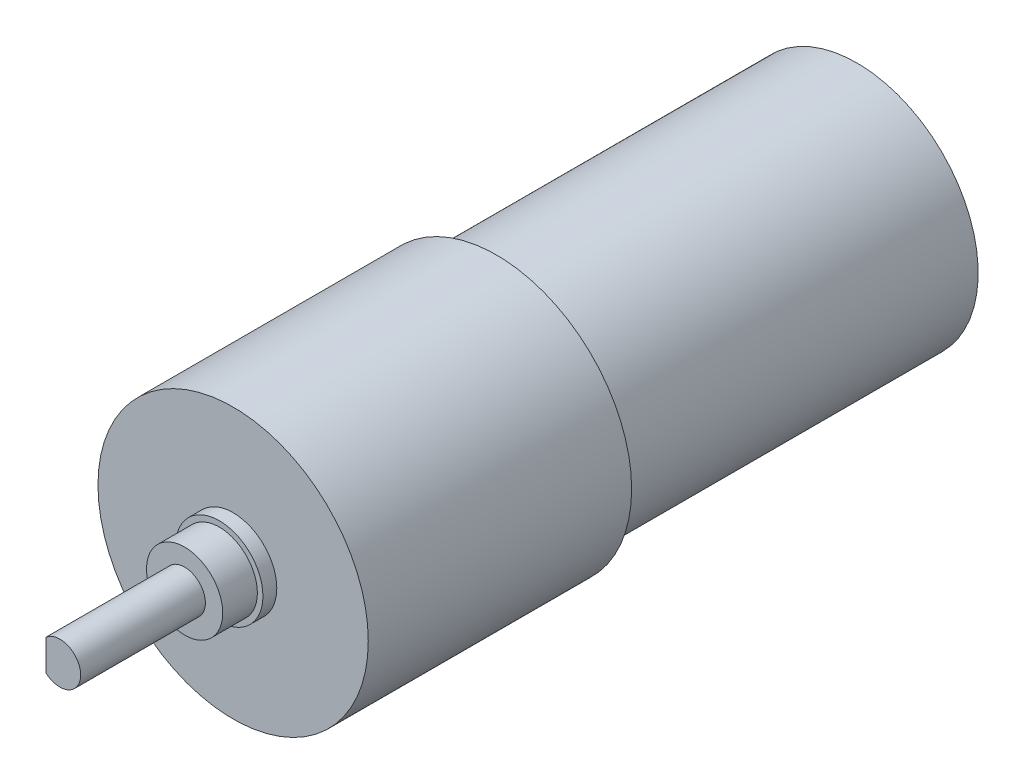
from build123d import *

# Parameters (mm, degrees)
SKETCH1_R           = 8.75
BOSS_EXTRUDE1_DEPTH = 26
SKETCH2_R           = 9.75
BOSS_EXTRUDE2_DEPTH = 19
SKETCH3_R           = 3.15
BOSS_EXTRUDE3_DEPTH = 1
SKETCH4_R           = 2.75
BOSS_EXTRUDE4_DEPTH = 2.5
BOSS_EXTRUDE5_DEPTH = 9


with BuildPart() as part:
    # Sketch1 → Boss-Extrude1 (new body)
    with BuildSketch(Plane.XY):
        with Locations(Location((0, 0, 0), (0, 0, 180))):
            Circle(SKETCH1_R)
    extrude(amount=BOSS_EXTRUDE1_DEPTH)

    # Sketch2 → Boss-Extrude2 (add)
    with BuildSketch(Plane.XY.offset(26)):
        Circle(SKETCH2_R)
    extrude(amount=BOSS_EXTRUDE2_DEPTH)

    # Sketch3 → Boss-Extrude3 (add)
    with BuildSketch(Plane.XY.offset(45)):
        Circle(SKETCH3_R)
    extrude(amount=BOSS_EXTRUDE3_DEPTH)

    # Sketch4 → Boss-Extrude4 (add)
    with BuildSketch(Plane.XY.offset(46)):
        Circle(SKETCH4_R)
    extrude(amount=BOSS_EXTRUDE4_DEPTH)

    # Sketch5 → Boss-Extrude5 (add)
    with BuildSketch(Plane.XY.offset(48.5)):
        with BuildLine():
            Line((-1, 1.118033989), (-1, -1.118033989))
            ThreePointArc((-1, -1.118033989), (1.5, 0), (-1, 1.118033989))
        make_face()
    extrude(amount=BOSS_EXTRUDE5_DEPTH)


solid = part.part
